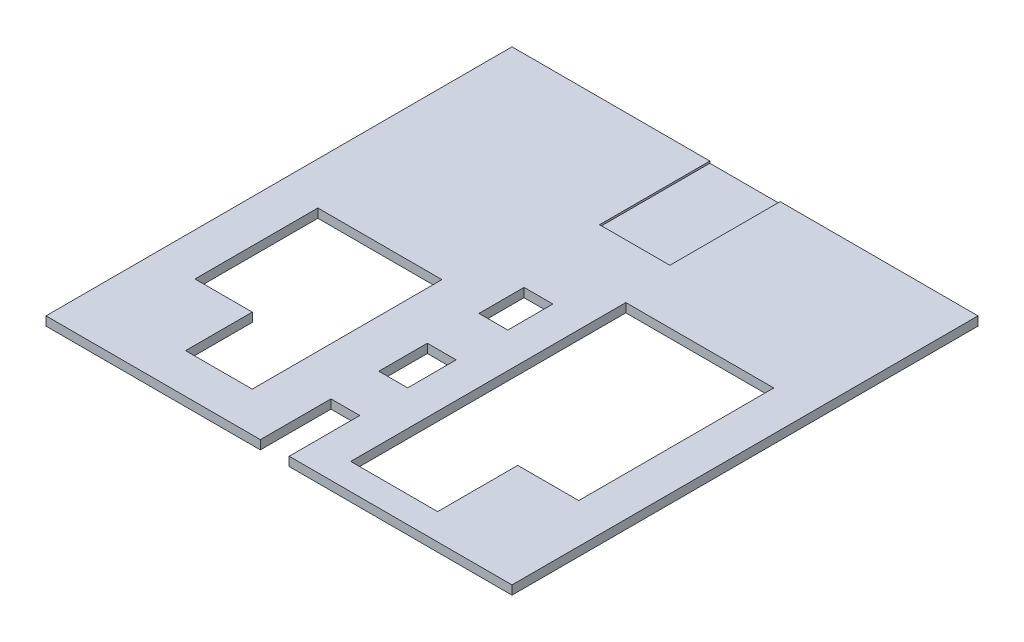
from build123d import *

# Parameters (mm, degrees)
SKETCH1_W           = 120
SKETCH1_H           = 120
BOSS_EXTRUDE1_DEPTH = 2.3
CUT_EXTRUDE1_REACH  = 171.721
SKETCH2_W           = 7.422122634
SKETCH2_H           = 18.177961541
SKETCH2_H_2         = 12.498339484
SKETCH2_H_3         = 11.613798671
SKETCH2_3_W         = 18.1
SKETCH2_3_H         = 28.4
CUT_EXTRUDE2_DEPTH  = 0.5


with BuildPart() as part:
    # Sketch1 → Boss-Extrude1 (new body)
    with BuildSketch(Plane(origin=(0, 0, 0), x_dir=(1, 0, 0), z_dir=(0, 1, 0))):
        with Locations((60, 60)):
            Rectangle(SKETCH1_W, SKETCH1_H)
    extrude(amount=BOSS_EXTRUDE1_DEPTH)

    # Sketch2 → Cut-Extrude1 (cut, up to next)
    with BuildSketch(Plane(origin=(0, 2.3, 0), x_dir=(1, 0, 0), z_dir=(0, 1, 0)), mode=Mode.PRIVATE) as cut_extrude1_sk1:
        Polygon((42.897324416, 59.05835662), (10.950631269, 59.05835662), (10.950631269, 27.396794206), (25.719897068, 27.396794206), (25.719897068, 10.210582129), (42.897324416, 10.210582129), align=None)
    cut_extrude1_tool1 = extrude(cut_extrude1_sk1.sketch, amount=-CUT_EXTRUDE1_REACH, mode=Mode.PRIVATE) & part.part
    # Sketch2 → Cut-Extrude1 (cut, up to next)
    with BuildSketch(Plane(origin=(0, 2.3, 0), x_dir=(1, 0, 0), z_dir=(0, 1, 0)), mode=Mode.PRIVATE) as cut_extrude1_sk2:
        Polygon((109.790535643, 77.620899486), (71.695725531, 77.620899486), (71.695725531, 6.770353139), (94.080420097, 6.770353139), (94.080420097, 27.396794206), (109.790535643, 27.396794206), align=None)
    cut_extrude1_tool2 = extrude(cut_extrude1_sk2.sketch, amount=-CUT_EXTRUDE1_REACH, mode=Mode.PRIVATE) & part.part
    # Sketch2 → Cut-Extrude1 (cut, up to next)
    with BuildSketch(Plane(origin=(0, 2.3, 0), x_dir=(1, 0, 0), z_dir=(0, 1, 0)), mode=Mode.PRIVATE) as cut_extrude1_sk3:
        with Locations((58.912993536, 9.088980771)):
            Rectangle(SKETCH2_W, SKETCH2_H)
    cut_extrude1_tool3 = extrude(cut_extrude1_sk3.sketch, amount=-CUT_EXTRUDE1_REACH, mode=Mode.PRIVATE) & part.part
    # Sketch2 → Cut-Extrude1 (cut, up to next)
    with BuildSketch(Plane(origin=(0, 2.3, 0), x_dir=(1, 0, 0), z_dir=(0, 1, 0)), mode=Mode.PRIVATE) as cut_extrude1_sk4:
        with Locations((58.912993536, 36.747395539)):
            Rectangle(SKETCH2_W, SKETCH2_H_2)
    cut_extrude1_tool4 = extrude(cut_extrude1_sk4.sketch, amount=-CUT_EXTRUDE1_REACH, mode=Mode.PRIVATE) & part.part
    # Sketch2 → Cut-Extrude1 (cut, up to next)
    with BuildSketch(Plane(origin=(0, 2.3, 0), x_dir=(1, 0, 0), z_dir=(0, 1, 0)), mode=Mode.PRIVATE) as cut_extrude1_sk5:
        with Locations((58.912993536, 62.090548619)):
            Rectangle(SKETCH2_W, SKETCH2_H_3)
    cut_extrude1_tool5 = extrude(cut_extrude1_sk5.sketch, amount=-CUT_EXTRUDE1_REACH, mode=Mode.PRIVATE) & part.part
    add(cut_extrude1_tool1.solids().sort_by_distance((28.592347, 2.3, -37.709621))[0], mode=Mode.SUBTRACT)
    add(cut_extrude1_tool2.solids().sort_by_distance((89.216049, 2.3, -45.62191))[0], mode=Mode.SUBTRACT)
    add(cut_extrude1_tool3.solids().sort_by_distance((58.912994, 2.3, -9.088981))[0], mode=Mode.SUBTRACT)
    add(cut_extrude1_tool4.solids().sort_by_distance((58.912994, 2.3, -36.747396))[0], mode=Mode.SUBTRACT)
    add(cut_extrude1_tool5.solids().sort_by_distance((58.912994, 2.3, -62.090549))[0], mode=Mode.SUBTRACT)

    # Sketch2<3> → Cut-Extrude2 (cut)
    with BuildSketch(Plane(origin=(0, 2.3, 0), x_dir=(1, 0, 0), z_dir=(0, 1, 0))):
        with Locations((60, 105.8)):
            Rectangle(SKETCH2_3_W, SKETCH2_3_H)
    extrude(amount=-CUT_EXTRUDE2_DEPTH, mode=Mode.SUBTRACT)


solid = part.part
